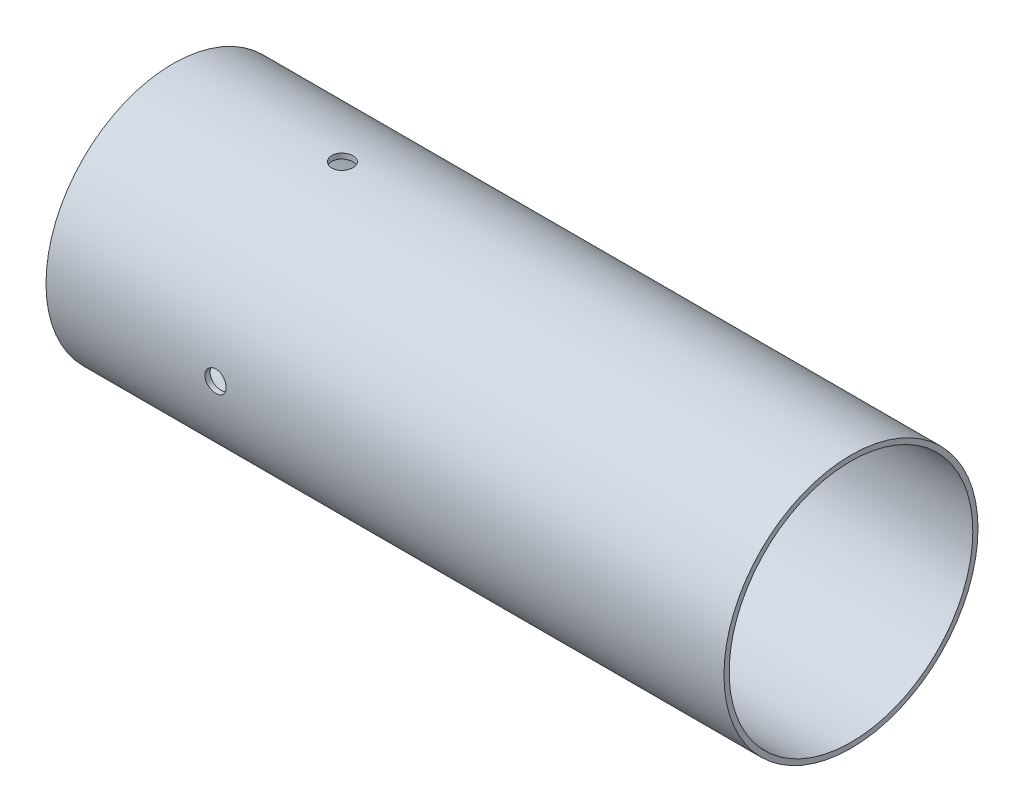
from build123d import *

# Parameters (mm, degrees)
SKETCH1_R           = 38.0746
SKETCH1_R_2         = 36.5125
BOSS_EXTRUDE1_DEPTH = 203.2
SKETCH3_R           = 3.175
CUT_EXTRUDE1_DEPTH  = 211.213202084
CIRPATTERN1_COUNT   = 4


with BuildPart() as part:
    # Sketch1 → Boss-Extrude1 (new body)
    with BuildSketch(Plane.YZ):
        with Locations(Location((0, 0, 0), (0, 0, 270))):
            Circle(SKETCH1_R)
        with Locations(Location((0, 0, 0), (0, 0, 270))):
            Circle(SKETCH1_R_2, mode=Mode.SUBTRACT)
    extrude(amount=BOSS_EXTRUDE1_DEPTH)

    # Sketch3 → Cut-Extrude1 (cut, through all)
    with BuildSketch(Plane(origin=(0, 0, 0), x_dir=(-1, 0, 0), z_dir=(0, 1, 0))):
        with Locations(Location((-50.8, 0, 0), (0, 0, 270))):
            Circle(SKETCH3_R)
    cut_extrude1 = extrude(amount=CUT_EXTRUDE1_DEPTH, mode=Mode.SUBTRACT)

    # CirPattern1: Cut-Extrude1 ×4 about axis
    cirpattern1_axis = Axis((203.2, 0, 0), (-1, 0, 0))
    for i in range(1, CIRPATTERN1_COUNT):
        add(cut_extrude1.rotate(cirpattern1_axis, i * 360 / CIRPATTERN1_COUNT), mode=Mode.SUBTRACT)


solid = part.part
